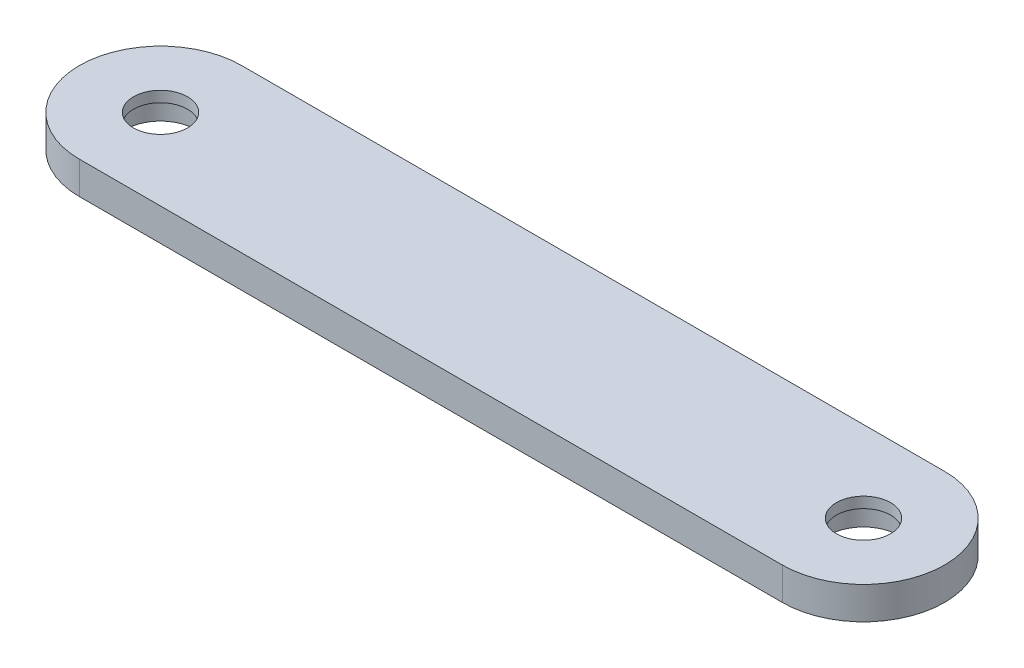
from build123d import *

# Parameters (mm, degrees)
SKETCH2_R           = 5
BOSS_EXTRUDE1_DEPTH = 6
SKETCH4_R           = 6.5
CUT_EXTRUDE1_DEPTH  = 4


with BuildPart() as part:
    # Sketch2 → Boss-Extrude1 (new body)
    with BuildSketch(Plane(origin=(0, 0, 0), x_dir=(1, 0, 0), z_dir=(0, 1, 0))):
        with BuildLine():
            Line((-6.5, 28.5), (123.5, 28.5))
            ThreePointArc((123.5, 28.5), (138.5, 13.5), (123.5, -1.5))
            Line((123.5, -1.5), (-6.5, -1.5))
            ThreePointArc((-6.5, -1.5), (-21.5, 13.5), (-6.5, 28.5))
        make_face()
        with Locations(Location((-6.5, 13.5, 0), (0, 0, 270))):
            Circle(SKETCH2_R, mode=Mode.SUBTRACT)
        with Locations(Location((123.5, 13.5, 0), (0, 0, 270))):
            Circle(SKETCH2_R, mode=Mode.SUBTRACT)
    extrude(amount=BOSS_EXTRUDE1_DEPTH)

    # Sketch4 → Cut-Extrude1 (cut)
    with BuildSketch(Plane.XZ):
        with Locations(Location((123.5, -13.5, 0), (0, 0, 270))):
            Circle(SKETCH4_R)
        with Locations(Location((-6.5, -13.5, 0), (0, 0, 270))):
            Circle(SKETCH4_R)
    extrude(amount=-CUT_EXTRUDE1_DEPTH, mode=Mode.SUBTRACT)


solid = part.part
